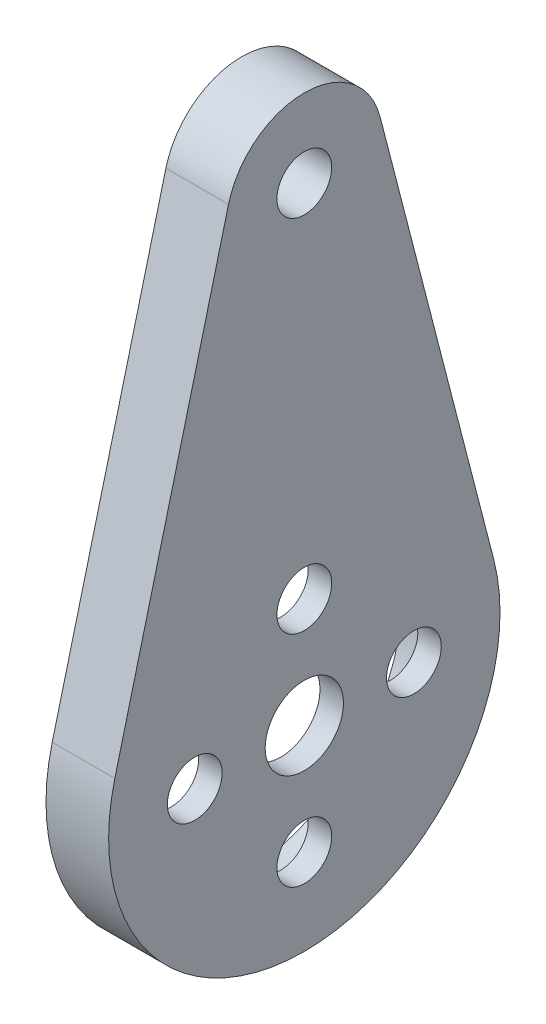
from build123d import *

# Parameters (mm, degrees)
SKETCH_1_R               = 1.75
SKETCH_1_R_2             = 2.5
EXTRUDE_1_DEPTH          = 4
SKETCH_2_R               = 1.75
CUT_EXTRUDE_1_DEPTH      = 4
PATTERN_CIRCULAR_1_COUNT = 4
SKETCH_4_R               = 10.25
CUT_EXTRUDE_2_DEPTH      = 2.5


with BuildPart() as part:
    # 草图1 → 凸台-拉伸1 (new body)
    with BuildSketch(Plane(origin=(0, 0, 0), x_dir=(0, 0, -1), z_dir=(1, 0, 0))):
        with BuildLine():
            Line((-4.841229183, 31.25), (-12.103072957, 3.125))
            ThreePointArc((-12.103072957, 3.125), (0, -12.5), (12.103072957, 3.125))
            Line((12.103072957, 3.125), (4.841229183, 31.25))
            ThreePointArc((4.841229183, 31.25), (0, 35), (-4.841229183, 31.25))
        make_face()
        with Locations((0, 30)):
            Circle(SKETCH_1_R, mode=Mode.SUBTRACT)
        Circle(SKETCH_1_R_2, mode=Mode.SUBTRACT)
    extrude(amount=EXTRUDE_1_DEPTH)

    # 草图2 → 切除-拉伸1 (cut)
    with BuildSketch(Plane(origin=(4, 0, 0), x_dir=(0, 0, -1), z_dir=(1, 0, 0))):
        with Locations((0, -7)):
            Circle(SKETCH_2_R)
    cut_extrude_1 = extrude(amount=-CUT_EXTRUDE_1_DEPTH, mode=Mode.SUBTRACT)

    # 阵列(圆周)1: 切除-拉伸1 ×4 about axis
    pattern_circular_1_axis = Axis((0, 0, 0), (1, 0, 0))
    for i in range(1, PATTERN_CIRCULAR_1_COUNT):
        add(cut_extrude_1.rotate(pattern_circular_1_axis, i * 360 / PATTERN_CIRCULAR_1_COUNT), mode=Mode.SUBTRACT)

    # 草图4 → 切除-拉伸2 (cut)
    with BuildSketch(Plane.ZY):
        Circle(SKETCH_4_R)
    extrude(amount=-CUT_EXTRUDE_2_DEPTH, mode=Mode.SUBTRACT)


solid = part.part
